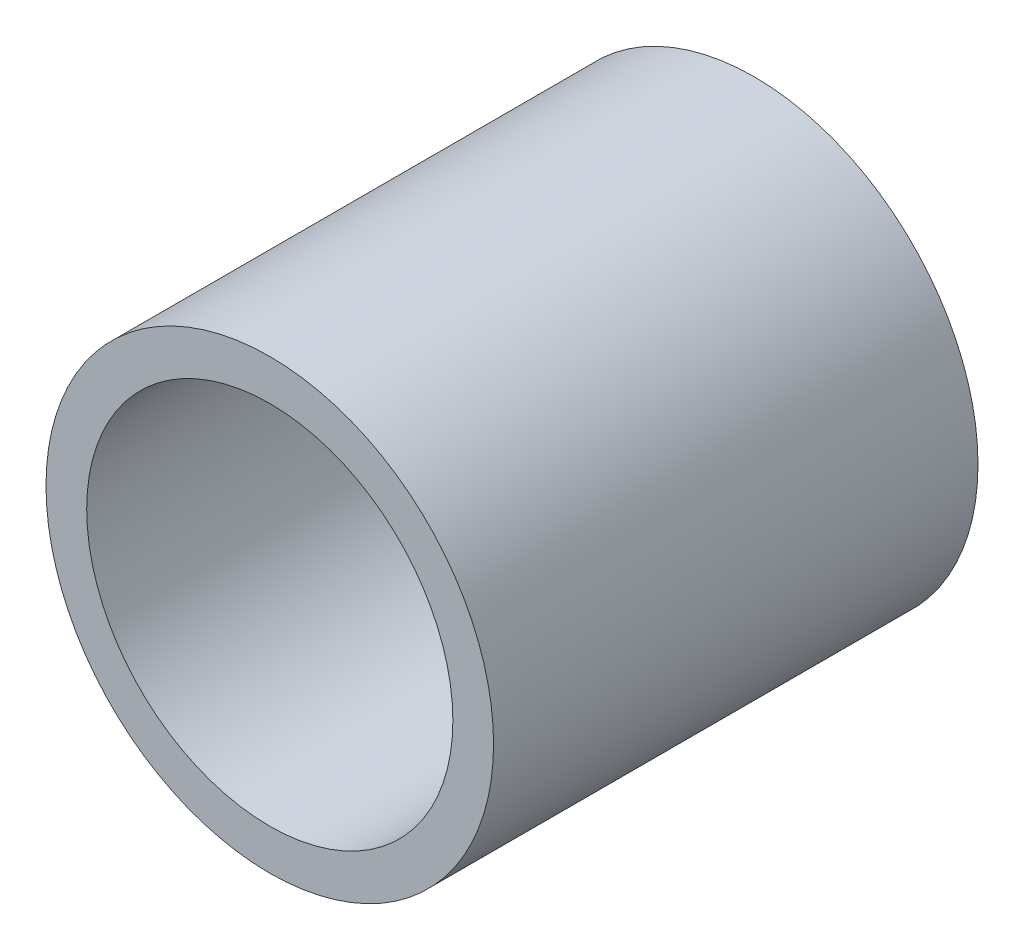
from build123d import *

# Parameters (mm, degrees)
CROQUIS1_W            = 23.812
CROQUIS1_H            = 11
CORTAR_EXTRUIR1_REACH = 30.443
CROQUIS2_R            = 9


with BuildPart() as part:
    # Croquis1 → Revolución1 (revolve)
    with BuildSketch(Plane(origin=(0, 0, 0), x_dir=(0, 0, -1), z_dir=(1, 0, 0)), mode=Mode.PRIVATE) as revoluci_n1_sk:
        with Locations((11.906, 5.5)):
            Rectangle(CROQUIS1_W, CROQUIS1_H)
    revolve(revoluci_n1_sk.sketch.rotate(Axis((0, 0, 0), (0, 0, -1)), 90), axis=Axis((0, 0, 0), (0, 0, -1)))

    # Croquis2 → Cortar-Extruir1 (cut, up to next)
    with BuildSketch(Plane.XY, mode=Mode.PRIVATE) as cortar_extruir1_sk1:
        Circle(CROQUIS2_R)
    cortar_extruir1_tool1 = extrude(cortar_extruir1_sk1.sketch, amount=-CORTAR_EXTRUIR1_REACH, mode=Mode.PRIVATE) & part.part
    add(cortar_extruir1_tool1.solids().sort_by_distance((0, 0, 0))[0], mode=Mode.SUBTRACT)


solid = part.part
